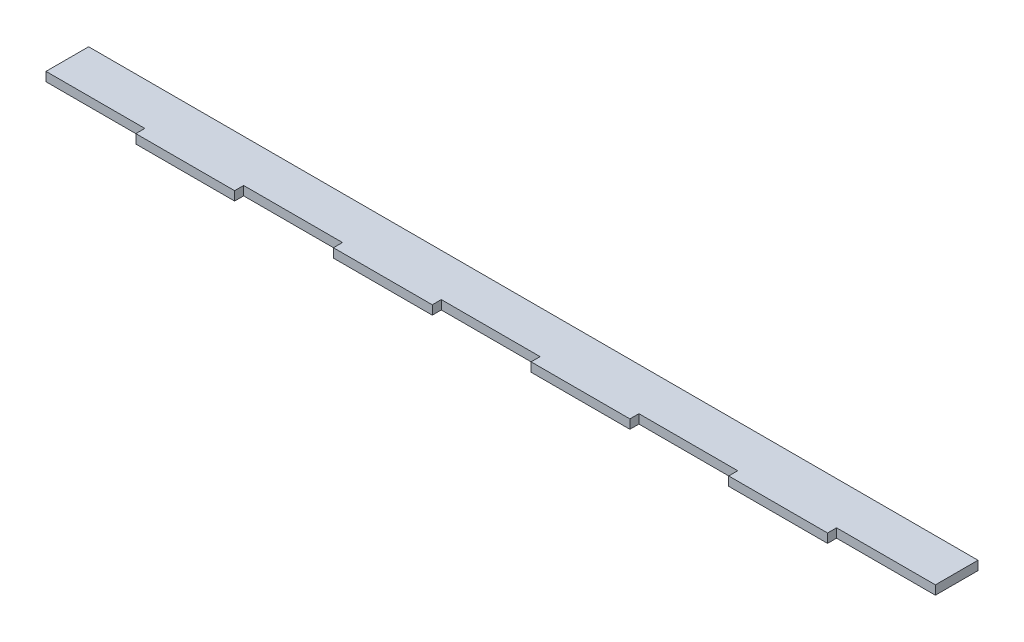
from build123d import *

# Parameters (mm, degrees)
BOSS_EXTRUDE1_DEPTH = 3.175


with BuildPart() as part:
    # Sketch1 → Boss-Extrude1 (new body)
    with BuildSketch(Plane(origin=(0, 0, 0), x_dir=(1, 0, 0), z_dir=(0, 1, 0))):
        Polygon((0, 0), (34.777777778, 0), (34.777777778, -3.175), (69.555555556, -3.175), (69.555555556, 0), (104.333333333, 0), (104.333333333, -3.175), (139.111111111, -3.175), (139.111111111, 0), (173.888888889, 0), (173.888888889, -3.175), (208.666666667, -3.175), (208.666666667, 0), (243.444444444, 0), (243.444444444, -3.175), (278.222222222, -3.175), (278.222222222, 0), (313, 0), (313, 15), (0, 15), align=None)
    extrude(amount=BOSS_EXTRUDE1_DEPTH)


solid = part.part
